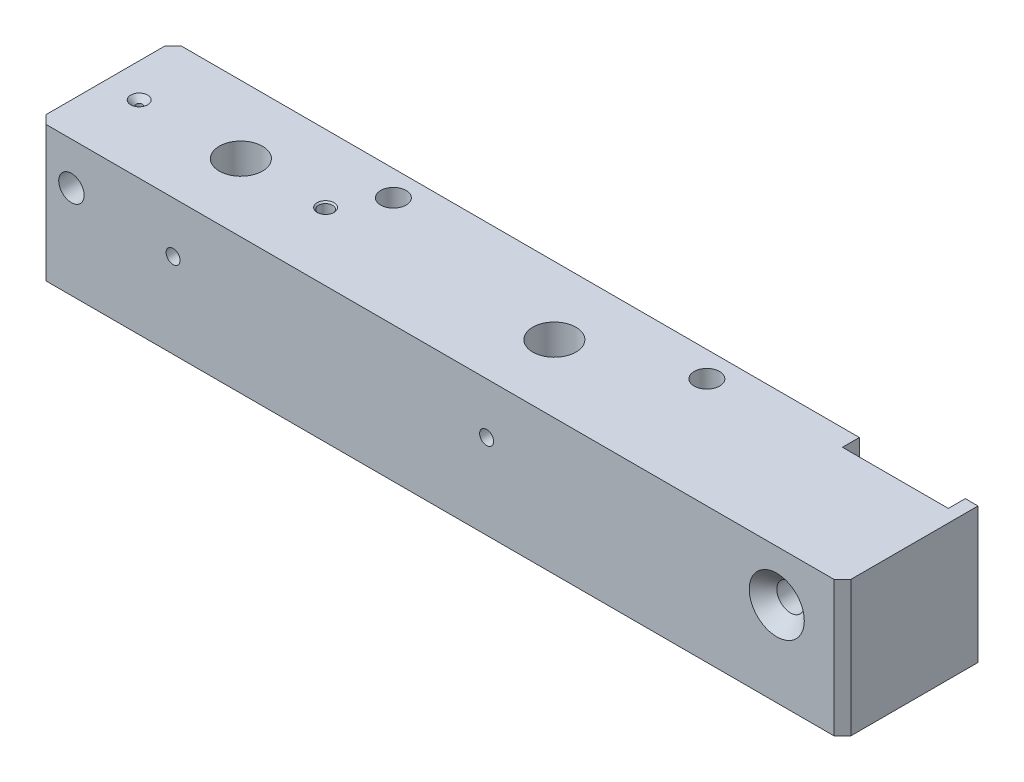
from build123d import *

# Parameters (mm, degrees)
SKETCH1_W                                            = 190
SKETCH1_H                                            = 32
BOSS_EXTRUDE1_DEPTH                                  = 16
SKETCH2_W                                            = 25
SKETCH2_H                                            = 4
CUT_EXTRUDE1_DEPTH                                   = 102.513545894
M12_TAPPED_HOLE1_D                                   = 10.2
M12_TAPPED_HOLE1_DEPTH                               = 24
M12_TAPPED_HOLE1_TIP                                 = 3.064389157
M4_TAPPED_HOLE1_D                                    = 3.3
M4_TAPPED_HOLE1_DEPTH                                = 11.5
M4_TAPPED_HOLE1_TIP                                  = 0.991420021
SKETCH13_R                                           = 3
CUT_EXTRUDE2_DEPTH                                   = 102.51354591
CSK_FOR_M4_COUNTERSUNK_FLAT_HEAD_SCREW1_D            = 1.5
CSK_FOR_M4_COUNTERSUNK_FLAT_HEAD_SCREW1_DEPTH        = 10
CSK_FOR_M4_COUNTERSUNK_FLAT_HEAD_SCREW1_CSINK_D      = 4
CSK_FOR_M4_COUNTERSUNK_FLAT_HEAD_SCREW1_CSINK_ANGLE  = 90
CSK_FOR_M4_COUNTERSUNK_FLAT_HEAD_SCREW1_TIP          = 0.450645464
M4_TAPPED_HOLE3_D                                    = 3.3
M4_TAPPED_HOLE3_DEPTH                                = 16
M4_TAPPED_HOLE3_CSINK_D                              = 4
M4_TAPPED_HOLE3_CSINK_ANGLE                          = 90
M4_TAPPED_HOLE3_TIP                                  = 0.991420021
SKETCH26_R                                           = 3
CUT_EXTRUDE4_DEPTH                                   = 32
CSK_FOR_M10_COUNTERSUNK_FLAT_HEAD_SCREW3_D           = 6.5
CSK_FOR_M10_COUNTERSUNK_FLAT_HEAD_SCREW3_CSINK_D     = 13
CSK_FOR_M10_COUNTERSUNK_FLAT_HEAD_SCREW3_CSINK_ANGLE = 90
CHAMFER3_SIZE                                        = 2


with BuildPart() as part:
    # Sketch1 → Boss-Extrude1 (new, symmetric)
    with BuildSketch(Plane.XY):
        Rectangle(SKETCH1_W, SKETCH1_H)
    extrude(amount=BOSS_EXTRUDE1_DEPTH, both=True)

    # Sketch2 → Cut-Extrude1 (cut, through all)
    with BuildSketch(Plane(origin=(0, 16, 0), x_dir=(1, 0, 0), z_dir=(0, 1, 0))):
        with Locations((79.5, 14)):
            Rectangle(SKETCH2_W, SKETCH2_H)
    extrude(amount=-CUT_EXTRUDE1_DEPTH, mode=Mode.SUBTRACT)

    # M12 Tapped Hole1
    with Locations(Plane(origin=(0, 16, 0), x_dir=(1, 0, 0), z_dir=(0, 1, 0))):
        with Locations((-63, 0), (11, 0)):
            Hole(M12_TAPPED_HOLE1_D / 2, depth=M12_TAPPED_HOLE1_DEPTH)
            with Locations((0, 0, -(M12_TAPPED_HOLE1_DEPTH + M12_TAPPED_HOLE1_TIP / 2))):  # 118° drill point
                Cone(0, M12_TAPPED_HOLE1_D / 2, M12_TAPPED_HOLE1_TIP, mode=Mode.SUBTRACT)

    # M4 Tapped Hole1
    with Locations(Plane.XY.offset(16)):
        with Locations((-63, 4), (11, 4)):
            Hole(M4_TAPPED_HOLE1_D / 2, depth=M4_TAPPED_HOLE1_DEPTH)
            with Locations((0, 0, -(M4_TAPPED_HOLE1_DEPTH + M4_TAPPED_HOLE1_TIP / 2))):  # 118° drill point
                Cone(0, M4_TAPPED_HOLE1_D / 2, M4_TAPPED_HOLE1_TIP, mode=Mode.SUBTRACT)

    # Sketch13 → Cut-Extrude2 (cut, through all)
    with BuildSketch(Plane.XY.offset(16)):
        with Locations((-87, 6)):
            Circle(SKETCH13_R)
    extrude(amount=-CUT_EXTRUDE2_DEPTH, mode=Mode.SUBTRACT)

    # CSK for M4 Countersunk Flat Head Screw1
    with Locations(Plane(origin=(0, 16, 0), x_dir=(1, 0, 0), z_dir=(0, 1, 0))):
        with Locations((-87, 0)):
            CounterSinkHole(CSK_FOR_M4_COUNTERSUNK_FLAT_HEAD_SCREW1_D / 2, CSK_FOR_M4_COUNTERSUNK_FLAT_HEAD_SCREW1_CSINK_D / 2, depth=CSK_FOR_M4_COUNTERSUNK_FLAT_HEAD_SCREW1_DEPTH, counter_sink_angle=CSK_FOR_M4_COUNTERSUNK_FLAT_HEAD_SCREW1_CSINK_ANGLE)
            with Locations((0, 0, -(CSK_FOR_M4_COUNTERSUNK_FLAT_HEAD_SCREW1_DEPTH + CSK_FOR_M4_COUNTERSUNK_FLAT_HEAD_SCREW1_TIP / 2))):  # 118° drill point
                Cone(0, CSK_FOR_M4_COUNTERSUNK_FLAT_HEAD_SCREW1_D / 2, CSK_FOR_M4_COUNTERSUNK_FLAT_HEAD_SCREW1_TIP, mode=Mode.SUBTRACT)

    # M4 Tapped Hole3
    with Locations(Plane(origin=(0, 16, 0), x_dir=(1, 0, 0), z_dir=(0, 1, 0))):
        with Locations((-43, 0)):
            CounterSinkHole(M4_TAPPED_HOLE3_D / 2, M4_TAPPED_HOLE3_CSINK_D / 2, depth=M4_TAPPED_HOLE3_DEPTH, counter_sink_angle=M4_TAPPED_HOLE3_CSINK_ANGLE)
            with Locations((0, 0, -(M4_TAPPED_HOLE3_DEPTH + M4_TAPPED_HOLE3_TIP / 2))):  # 118° drill point
                Cone(0, M4_TAPPED_HOLE3_D / 2, M4_TAPPED_HOLE3_TIP, mode=Mode.SUBTRACT)

    # Sketch26 → Cut-Extrude4 (cut)
    with BuildSketch(Plane(origin=(0, 16, 0), x_dir=(1, 0, 0), z_dir=(0, 1, 0))):
        with Locations(Location((-37, 10, 0), (0, 0, 180))):
            Circle(SKETCH26_R)
        with Locations(Location((37, 10, 0), (0, 0, 180))):
            Circle(SKETCH26_R)
    extrude(amount=-CUT_EXTRUDE4_DEPTH, mode=Mode.SUBTRACT)

    # CSK for M10 Countersunk Flat Head Screw3 (through all)
    with Locations(Plane.XY.offset(16)):
        with Locations((79.5, 4)):
            CounterSinkHole(CSK_FOR_M10_COUNTERSUNK_FLAT_HEAD_SCREW3_D / 2, CSK_FOR_M10_COUNTERSUNK_FLAT_HEAD_SCREW3_CSINK_D / 2, counter_sink_angle=CSK_FOR_M10_COUNTERSUNK_FLAT_HEAD_SCREW3_CSINK_ANGLE)

    # Chamfer3
    chamfer3_edges = [part.edges().sort_by_distance(p)[0] for p in [
        (95, 0, 16),
        (-95, 0, 16),
        (-95, 0, -16),
    ]]
    chamfer(chamfer3_edges, length=CHAMFER3_SIZE)


solid = part.part
